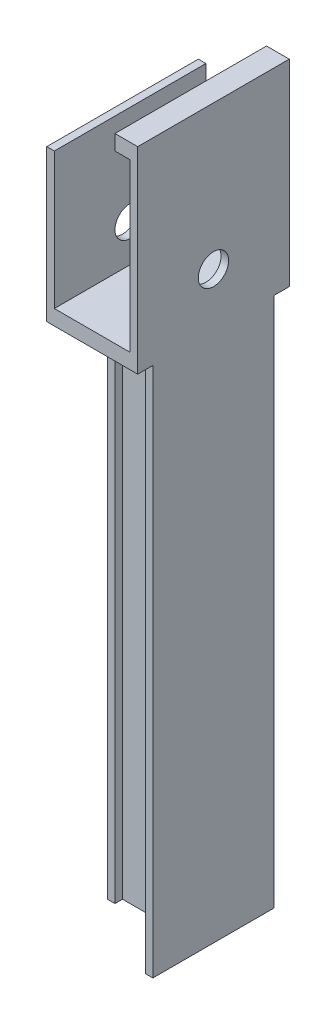
from build123d import *

# Parameters (mm, degrees)
SKETCH1_W           = 60
SKETCH1_H           = 100
BOSS_EXTRUDE1_DEPTH = 100
SKETCH2_W           = 50
SKETCH2_H           = 100
CUT_EXTRUDE1_DEPTH  = 40
SKETCH3_W           = 5
SKETCH3_H           = 100
BOSS_EXTRUDE2_DEPTH = 30
SKETCH4_W           = 100
SKETCH4_H           = 10
BOSS_EXTRUDE3_DEPTH = 10
SKETCH5_W           = 60
SKETCH5_H           = 80
BOSS_EXTRUDE4_DEPTH = 350
SKETCH6_W           = 50
SKETCH6_H           = 100
CUT_EXTRUDE2_DEPTH  = 50
SKETCH7_R           = 10
CUT_EXTRUDE3_DEPTH  = 80
SKETCH8_W           = 50
SKETCH8_H           = 35
CUT_EXTRUDE4_DEPTH  = 350
SKETCH9_W           = 5
SKETCH9_H           = 30
CUT_EXTRUDE5_DEPTH  = 350


with BuildPart() as part:
    # Sketch1 → Boss-Extrude1 (new body)
    with BuildSketch(Plane(origin=(0, 0, 0), x_dir=(1, 0, 0), z_dir=(0, 1, 0))):
        with Locations((-100.731707317, 49.268292683)):
            Rectangle(SKETCH1_W, SKETCH1_H)
    extrude(amount=BOSS_EXTRUDE1_DEPTH)

    # Sketch2 → Cut-Extrude1 (cut)
    with BuildSketch(Plane(origin=(0, 100, 0), x_dir=(1, 0, 0), z_dir=(0, 1, 0))):
        with Locations((-100.731707317, 49.268292683)):
            Rectangle(SKETCH2_W, SKETCH2_H)
    extrude(amount=-CUT_EXTRUDE1_DEPTH, mode=Mode.SUBTRACT)

    # Sketch3 → Boss-Extrude2 (add)
    with BuildSketch(Plane(origin=(0, 100, 0), x_dir=(1, 0, 0), z_dir=(0, 1, 0))):
        with Locations((-73.231707317, 49.268292683)):
            Rectangle(SKETCH3_W, SKETCH3_H)
    extrude(amount=BOSS_EXTRUDE2_DEPTH)

    # Sketch4 → Boss-Extrude3 (add)
    with BuildSketch(Plane.ZY.offset(75.731707317)):
        with Locations((-49.268292683, 125)):
            Rectangle(SKETCH4_W, SKETCH4_H)
    extrude(amount=BOSS_EXTRUDE3_DEPTH)

    # Sketch5 → Boss-Extrude4 (add)
    with BuildSketch(Plane(origin=(0, 0, 0), x_dir=(-1, 0, 0), z_dir=(0, -1, 0))):
        with Locations((100.731707317, 49.268292683)):
            Rectangle(SKETCH5_W, SKETCH5_H)
    extrude(amount=BOSS_EXTRUDE4_DEPTH)

    # Sketch6 → Cut-Extrude2 (cut)
    with BuildSketch(Plane(origin=(0, 60, 0), x_dir=(1, 0, 0), z_dir=(0, 1, 0))):
        with Locations((-100.731707317, 49.268292683)):
            Rectangle(SKETCH6_W, SKETCH6_H)
    extrude(amount=-CUT_EXTRUDE2_DEPTH, mode=Mode.SUBTRACT)

    # Sketch7 → Cut-Extrude3 (cut)
    with BuildSketch(Plane.ZY.offset(130.731707317)):
        with Locations((-49.268292683, 35)):
            Circle(SKETCH7_R)
    extrude(amount=-CUT_EXTRUDE3_DEPTH, mode=Mode.SUBTRACT)

    # Sketch8 → Cut-Extrude4 (cut)
    with BuildSketch(Plane(origin=(0, -350, 0), x_dir=(-1, 0, 0), z_dir=(0, -1, 0))):
        with Locations((100.731707317, 26.768292683)):
            Rectangle(SKETCH8_W, SKETCH8_H)
        with Locations((100.731707317, 71.768292683)):
            Rectangle(SKETCH8_W, SKETCH8_H)
    extrude(amount=-CUT_EXTRUDE4_DEPTH, mode=Mode.SUBTRACT)

    # Sketch9 → Cut-Extrude5 (cut)
    with BuildSketch(Plane(origin=(0, -350, 0), x_dir=(-1, 0, 0), z_dir=(0, -1, 0))):
        with Locations((128.231707317, 74.268292683)):
            Rectangle(SKETCH9_W, SKETCH9_H)
        with Locations((128.231707317, 24.268292683)):
            Rectangle(SKETCH9_W, SKETCH9_H)
    extrude(amount=-CUT_EXTRUDE5_DEPTH, mode=Mode.SUBTRACT)


solid = part.part
